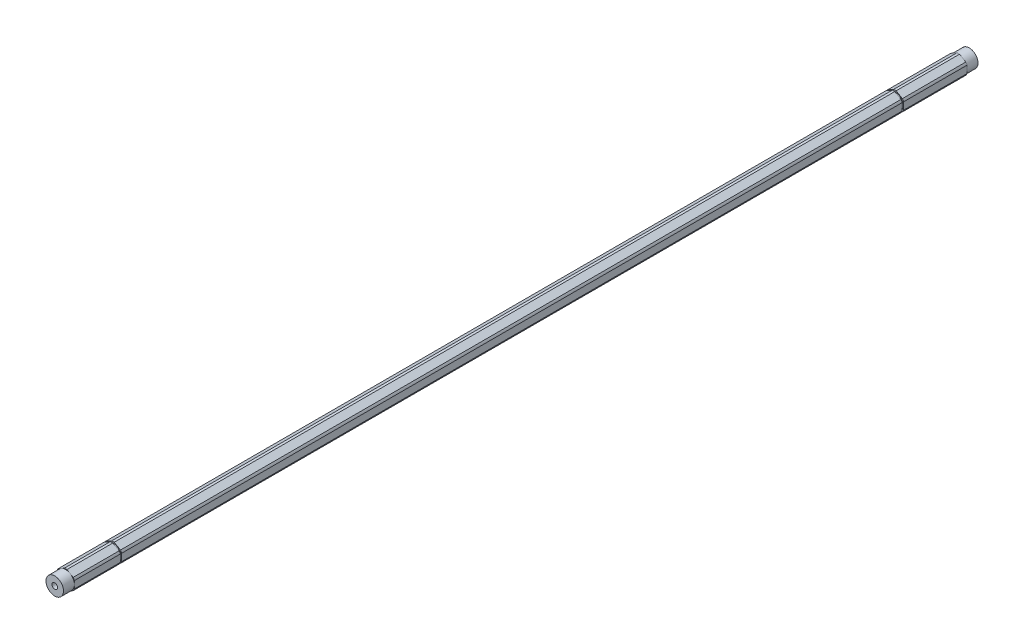
from build123d import *

# Parameters (mm, degrees)
SKETCH1_R                            = 2.0193
BOSS_EXTRUDE1_DEPTH                  = 331.7875
SKETCH2_R                            = 8.89
SKETCH2_R_2                          = 6.35
CUT_EXTRUDE_THIN1_DEPTH              = 7.9375
SKETCH3_W                            = 2.21098701
SKETCH3_H                            = 0.9906
SKETCH3_W_2                          = 2.67360648
F_10_32_TAPPED_HOLE1_D               = 4.0386
F_10_32_TAPPED_HOLE1_DEPTH           = 12.02944
F_10_32_TAPPED_HOLE1_TIP             = 1.213317848
F_10_32_TAPPED_HOLE1_ON_FACE_2_D     = 4.0386
F_10_32_TAPPED_HOLE1_ON_FACE_2_DEPTH = 12.02944
F_10_32_TAPPED_HOLE1_ON_FACE_2_TIP   = 1.213317848


with BuildPart() as part:
    # Sketch1 → Boss-Extrude1 (new, symmetric)
    with BuildSketch(Plane.XY):
        with BuildLine():
            ThreePointArc((0.893039571, 6.816751782), (0, 6.874999966), (-0.893039571, 6.816751782))
            Line((-0.893039571, 6.816751782), (-5.456960429, 4.181770846))
            ThreePointArc((-5.456960429, 4.181770846), (-5.953924622, 3.437499983), (-6.35, 2.634980936))
            Line((-6.35, 2.634980936), (-6.35, -2.634980936))
            ThreePointArc((-6.35, -2.634980936), (-5.953924622, -3.437499983), (-5.456960429, -4.181770846))
            Line((-5.456960429, -4.181770846), (-0.893039571, -6.816751782))
            ThreePointArc((-0.893039571, -6.816751782), (0, -6.874999966), (0.893039571, -6.816751782))
            Line((0.893039571, -6.816751782), (5.456960429, -4.181770846))
            ThreePointArc((5.456960429, -4.181770846), (5.953924622, -3.437499983), (6.35, -2.634980936))
            Line((6.35, -2.634980936), (6.35, 2.634980936))
            ThreePointArc((6.35, 2.634980936), (5.953924622, 3.437499983), (5.456960429, 4.181770846))
            Line((5.456960429, 4.181770846), (0.893039571, 6.816751782))
        make_face()
        Circle(SKETCH1_R, mode=Mode.SUBTRACT)
    extrude(amount=BOSS_EXTRUDE1_DEPTH, both=True)

    # Sketch2 → Cut-Extrude-Thin1 (cut)
    with BuildSketch(Plane(origin=(0, 0, -331.7875), x_dir=(-1, 0, 0), z_dir=(0, 0, -1))):
        Circle(SKETCH2_R)
        Circle(SKETCH2_R_2, mode=Mode.SUBTRACT)
    cut_extrude_thin1 = extrude(amount=-CUT_EXTRUDE_THIN1_DEPTH, mode=Mode.SUBTRACT)

    # Sketch3 → Cut-Revolve4 (revolve, cut)
    with BuildSketch(Plane(origin=(0, 0, 0), x_dir=(1, 0, 0), z_dir=(0, 1, 0))):
        with Locations((7.049093505, -290.0172)):
            Rectangle(SKETCH3_W, SKETCH3_H)
        with Locations((7.28040324, 277.3172)):
            Rectangle(SKETCH3_W_2, SKETCH3_H)
    revolve(axis=Axis((0, 0, -323.85), (0, 0, -1)), mode=Mode.SUBTRACT)

    # Mirror1: Cut-Extrude-Thin1 across plane
    add(cut_extrude_thin1.mirror(Plane.XY), mode=Mode.SUBTRACT)

    # #10-32 Tapped Hole1
    with Locations(Plane(origin=(0, 0, -331.7875), x_dir=(-1, 0, 0), z_dir=(0, 0, -1))):
        with Locations((0, 0)):
            Hole(F_10_32_TAPPED_HOLE1_D / 2, depth=F_10_32_TAPPED_HOLE1_DEPTH)
            with Locations((0, 0, -(F_10_32_TAPPED_HOLE1_DEPTH + F_10_32_TAPPED_HOLE1_TIP / 2))):  # 118° drill point
                Cone(0, F_10_32_TAPPED_HOLE1_D / 2, F_10_32_TAPPED_HOLE1_TIP, mode=Mode.SUBTRACT)

    # #10-32 Tapped Hole1 on face 2
    with Locations(Plane(origin=(0, 0, 331.7875), x_dir=(-1, 0, 0), z_dir=(0, 0, -1))):
        with Locations((0, 0)):
            Hole(F_10_32_TAPPED_HOLE1_ON_FACE_2_D / 2, depth=F_10_32_TAPPED_HOLE1_ON_FACE_2_DEPTH)
            with Locations((0, 0, -(F_10_32_TAPPED_HOLE1_ON_FACE_2_DEPTH + F_10_32_TAPPED_HOLE1_ON_FACE_2_TIP / 2))):  # 118° drill point
                Cone(0, F_10_32_TAPPED_HOLE1_ON_FACE_2_D / 2, F_10_32_TAPPED_HOLE1_ON_FACE_2_TIP, mode=Mode.SUBTRACT)


solid = part.part
